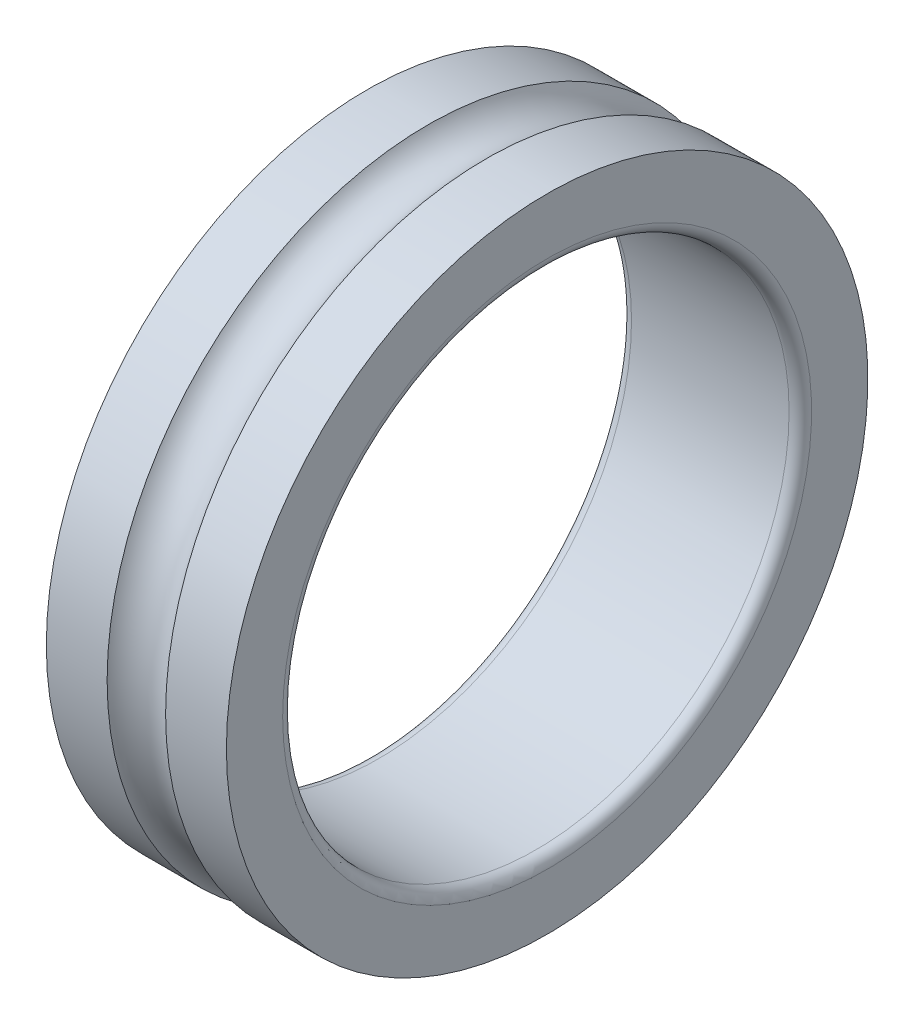
from build123d import *


with BuildPart() as part:
    # Sketch1 → Revolve1 (revolve)
    with BuildSketch(Plane.XY, mode=Mode.PRIVATE) as revolve1_sk:
        with BuildLine():
            Line((1, 22.5), (15, 22.5))
            ThreePointArc((15, 22.5), (15.707106781, 22.792893219), (16, 23.5))
            Line((16, 23.5), (16, 28.5))
            Line((16, 28.5), (10.598076211, 28.5))
            ThreePointArc((10.598076211, 28.5), (8, 27), (5.401923789, 28.5))
            Line((5.401923789, 28.5), (0, 28.5))
            Line((0, 28.5), (0, 23.5))
            ThreePointArc((0, 23.5), (0.292893219, 22.792893219), (1, 22.5))
        make_face()
    revolve(revolve1_sk.sketch.rotate(Axis((16, 0, 0), (-1, 0, 0)), 270), axis=Axis((16, 0, 0), (-1, 0, 0)))


solid = part.part
